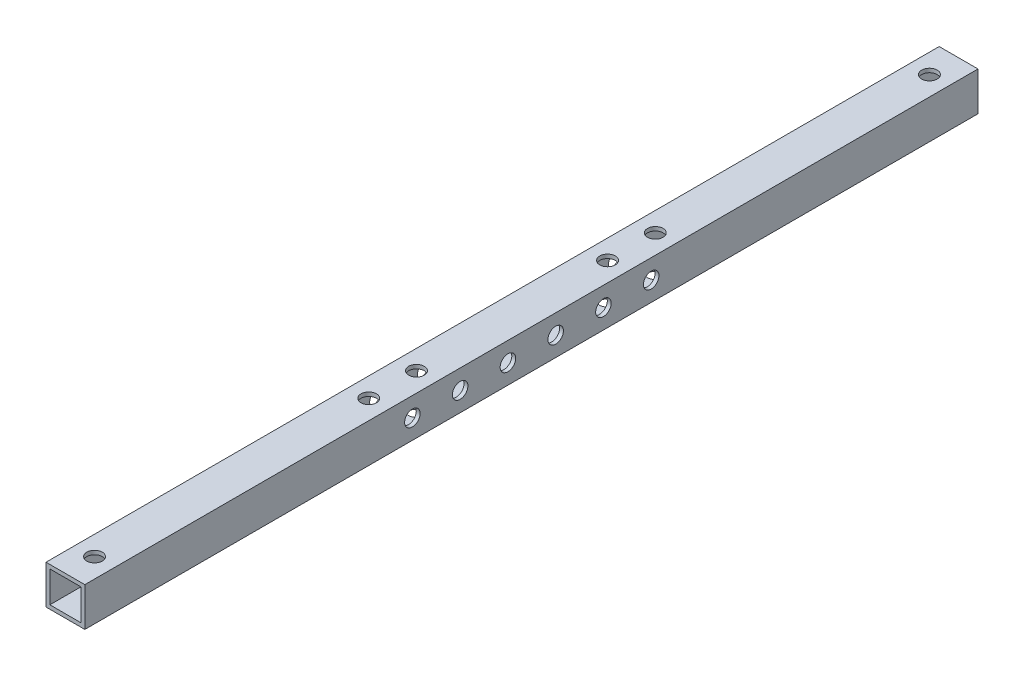
from build123d import *

# Parameters (mm, degrees)
SKETCH1_W           = 20
SKETCH1_H           = 20
SKETCH1_W_2         = 16
SKETCH1_H_2         = 16
BOSS_EXTRUDE1_DEPTH = 460.04
SKETCH2_R           = 4
CUT_EXTRUDE1_DEPTH  = 461.583110415
SKETCH5_R           = 4
CUT_EXTRUDE2_DEPTH  = 461.583110415
LPATTERN1_COUNT     = 6
LPATTERN1_PITCH     = 24.6
SKETCH6_R           = 4
CUT_EXTRUDE3_DEPTH  = 461.583110415


with BuildPart() as part:
    # Sketch1 → Boss-Extrude1 (new body)
    with BuildSketch(Plane.XY):
        Rectangle(SKETCH1_W, SKETCH1_H)
        Rectangle(SKETCH1_W_2, SKETCH1_H_2, mode=Mode.SUBTRACT)
    extrude(amount=BOSS_EXTRUDE1_DEPTH)

    # Sketch2 → Cut-Extrude1 (cut, through all)
    with BuildSketch(Plane(origin=(0, 10, 0), x_dir=(1, 0, 0), z_dir=(0, 1, 0))):
        with Locations(Location((0, -15, 0), (0, 0, 270))):
            Circle(SKETCH2_R)
    cut_extrude1 = extrude(amount=-CUT_EXTRUDE1_DEPTH, mode=Mode.SUBTRACT)

    # Mirror1: Cut-Extrude1 across plane
    add(cut_extrude1.mirror(Plane.XY.offset(230.02)), mode=Mode.SUBTRACT)

    # Sketch5 → Cut-Extrude2 (cut, through all)
    with BuildSketch(Plane(origin=(10, 0, 0), x_dir=(0, 0, -1), z_dir=(1, 0, 0))):
        with Locations(Location((-291.33, 0, 0), (0, 0, 90))):
            Circle(SKETCH5_R)
    cut_extrude2 = extrude(amount=-CUT_EXTRUDE2_DEPTH, mode=Mode.SUBTRACT)

    # LPattern1: Cut-Extrude2 ×6
    with Locations(*[(0, 0, -i * LPATTERN1_PITCH) for i in range(1, LPATTERN1_COUNT)]):
        add(cut_extrude2, mode=Mode.SUBTRACT)

    # Sketch6 → Cut-Extrude3 (cut, through all)
    with BuildSketch(Plane(origin=(0, 10, 0), x_dir=(1, 0, 0), z_dir=(0, 1, 0))):
        with Locations(Location((0, -303.82, 0), (0, 0, 270))):
            Circle(SKETCH6_R)
        with Locations(Location((0, -279.22, 0), (0, 0, 270))):
            Circle(SKETCH6_R)
    cut_extrude3 = extrude(amount=-CUT_EXTRUDE3_DEPTH, mode=Mode.SUBTRACT)

    # Mirror2: Cut-Extrude3 across plane
    add(cut_extrude3.mirror(Plane.XY.offset(230.02)), mode=Mode.SUBTRACT)


solid = part.part
